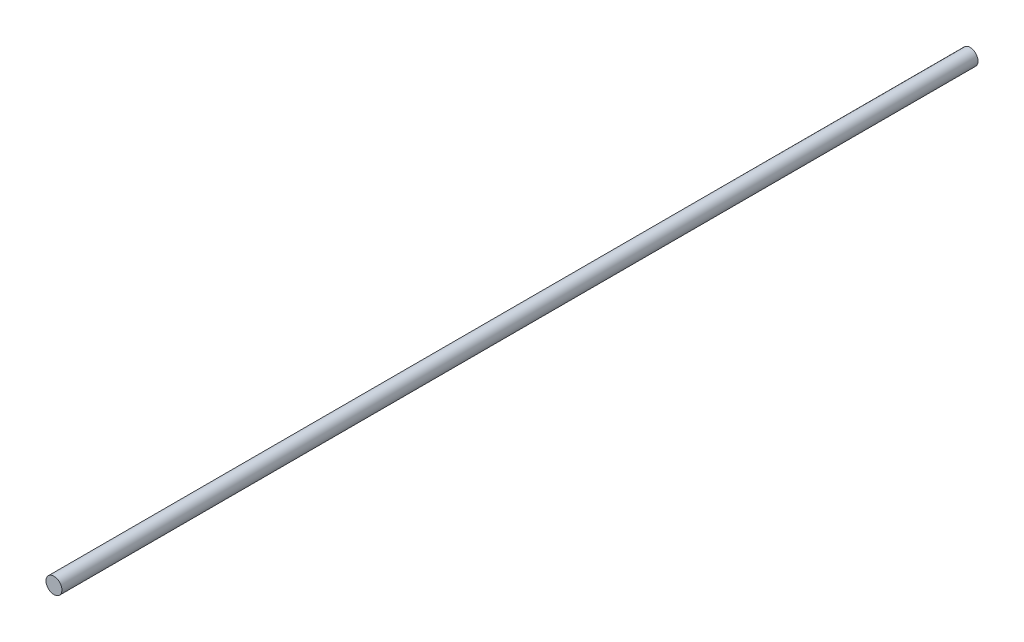
from build123d import *

# Parameters (mm, degrees)
SKICA1_R                = 4
P_IDAT_VYSUNUT_M1_DEPTH = 460


with BuildPart() as part:
    # Skica1 → Přidat vysunutím1 (new body)
    with BuildSketch(Plane.XY):
        Circle(SKICA1_R)
    extrude(amount=P_IDAT_VYSUNUT_M1_DEPTH)


solid = part.part
